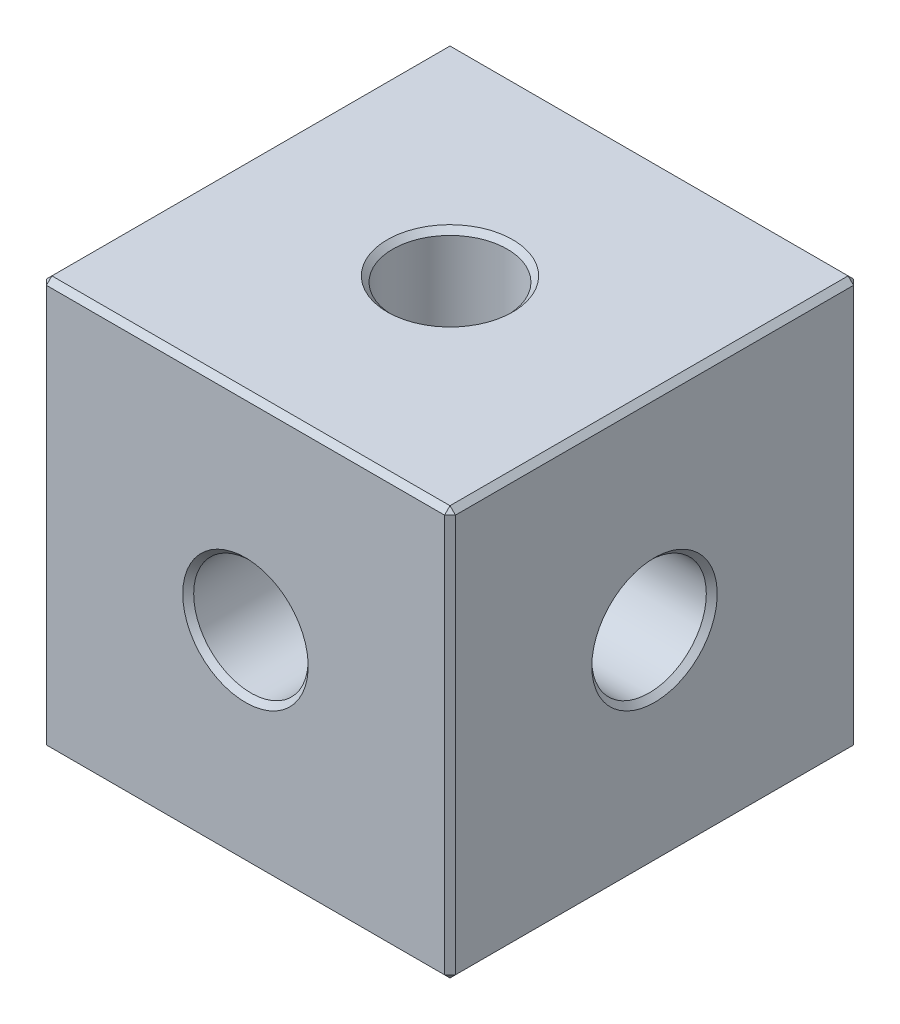
from build123d import *

# Parameters (mm, degrees)
SKETCH_1_W         = 15
SKETCH_1_H         = 15
EXTRUDE_1_DEPTH    = 7.5
HOLE_WIZARD_M5_1_D = 4.2
HOLE_WIZARD_M5_2_D = 4.2
HOLE_WIZARD_M5_3_D = 4.2
CHAMFER_1_SIZE     = 0.2


with BuildPart() as part:
    # 草图1 → 凸台-拉伸1 (new, symmetric)
    with BuildSketch(Plane(origin=(0, 0, 0), x_dir=(1, 0, 0), z_dir=(0, 1, 0))):
        Rectangle(SKETCH_1_W, SKETCH_1_H)
    extrude(amount=EXTRUDE_1_DEPTH, both=True)

    # M5 螺纹孔1 (through all)
    with Locations(Plane.XY.offset(7.5)):
        with Locations((0, 0)):
            Hole(HOLE_WIZARD_M5_1_D / 2)

    # M5 螺纹孔2 (through all)
    with Locations(Plane(origin=(0, 7.5, 0), x_dir=(1, 0, 0), z_dir=(0, 1, 0))):
        with Locations((0, 0)):
            Hole(HOLE_WIZARD_M5_2_D / 2)

    # M5 螺纹孔3 (through all)
    with Locations(Plane(origin=(7.5, 0, 0), x_dir=(0, 0, -1), z_dir=(1, 0, 0))):
        with Locations((0, 0)):
            Hole(HOLE_WIZARD_M5_3_D / 2)

    # 倒角1
    chamfer_1_edges = [part.edges().sort_by_distance(p)[0] for p in [
        (-7.5, 7.5, 0),
        (2.1, 0, 7.5),
        (2.1, 0, -7.5),
        (0, 7.5, 7.5),
        (2.1, -7.5, 0),
        (2.1, 7.5, 0),
        (-7.5, 0, -2.1),
        (7.5, 0, -2.1),
        (7.5, 7.5, 0),
        (0, -7.5, 7.5),
        (-7.5, -7.5, 0),
        (0, -7.5, -7.5),
        (7.5, -7.5, 0),
        (7.5, 0, 7.5),
        (-7.5, 0, 7.5),
        (-7.5, 0, -7.5),
        (7.5, 0, -7.5),
        (0, 7.5, -7.5),
    ]]
    chamfer(chamfer_1_edges, length=CHAMFER_1_SIZE)


solid = part.part
